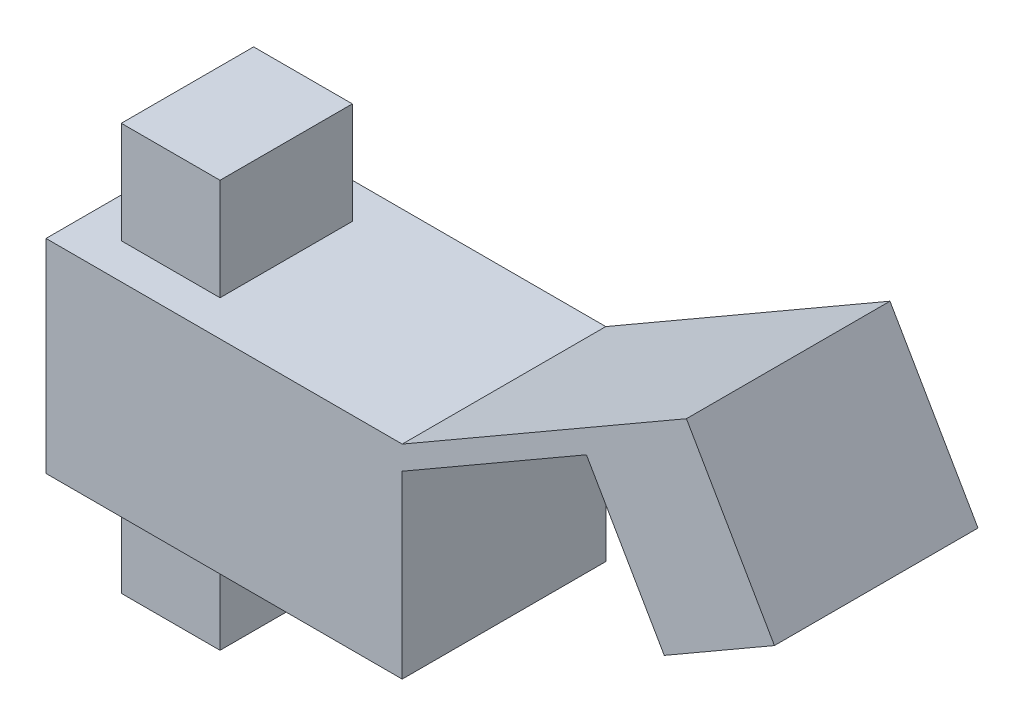
from build123d import *

# Parameters (mm, degrees)
SALIENTE_EXTRUIR1_DEPTH      = 20
SALIENTE_EXTRUIR2_DEPTH      = 20
SALIENTE_EXTRUIR2_DEPTH_BACK = 60
CROQUIS2_W                   = 19.396492872
CROQUIS2_H                   = 26
CORTAR_EXTRUIR1_DEPTH        = 18
CORTAR_EXTRUIR1_DEPTH_BACK   = 18
CORTAR_EXTRUIR1_START        = -20
CROQUIS4_W                   = 66
CROQUIS4_H                   = 36
CORTAR_EXTRUIR2_DEPTH        = 9
CORTAR_EXTRUIR2_DEPTH_BACK   = 9
CORTAR_EXTRUIR2_START        = -13
CROQUIS6_W                   = 11.396492872
CROQUIS6_H                   = 72


with BuildPart() as part:
    # Croquis1 → Saliente-Extruir1 (new, symmetric)
    with BuildSketch(Plane.XY):
        Polygon((65.424276511, 73.988341167), (80.72172581, 47.492381754), (102.372360904, 59.992381754), (85.074911605, 89.952442782), (29.226887967, 57.7085713), (-40.773112033, 57.7085713), (-40.773112033, 17.7085713), (29.226887967, 17.7085713), (29.226887967, 53.089769147), align=None)
    extrude(amount=SALIENTE_EXTRUIR1_DEPTH, both=True)

    # Croquis2 → Saliente-Extruir2 (add, two sides: drawn at the far end of the back side and taken through both)
    with BuildSketch(Plane(origin=(0, 57.7085713, 0), x_dir=(1, 0, 0), z_dir=(0, 1, 0)).offset(-SALIENTE_EXTRUIR2_DEPTH_BACK)):
        with Locations((-23.273112033, 0)):
            Rectangle(CROQUIS2_W, CROQUIS2_H)
    extrude(amount=SALIENTE_EXTRUIR2_DEPTH + SALIENTE_EXTRUIR2_DEPTH_BACK)

    # Croquis4 → Cortar-Extruir1 (cut, two sides: drawn at the far end of the back side and taken through both)
    with BuildSketch(Plane.XY.offset(20).offset(CORTAR_EXTRUIR1_START - CORTAR_EXTRUIR1_DEPTH_BACK)):
        with Locations((-5.773112033, 37.7085713)):
            Rectangle(CROQUIS4_W, CROQUIS4_H)
    extrude(amount=CORTAR_EXTRUIR1_DEPTH + CORTAR_EXTRUIR1_DEPTH_BACK, mode=Mode.SUBTRACT)

    # Croquis6 → Cortar-Extruir2 (cut, two sides: drawn at the far end of the back side and taken through both)
    with BuildSketch(Plane.XY.offset(13).offset(CORTAR_EXTRUIR2_START - CORTAR_EXTRUIR2_DEPTH_BACK)):
        with Locations((-23.273112033, 37.7085713)):
            Rectangle(CROQUIS6_W, CROQUIS6_H)
    extrude(amount=CORTAR_EXTRUIR2_DEPTH + CORTAR_EXTRUIR2_DEPTH_BACK, mode=Mode.SUBTRACT)


solid = part.part
